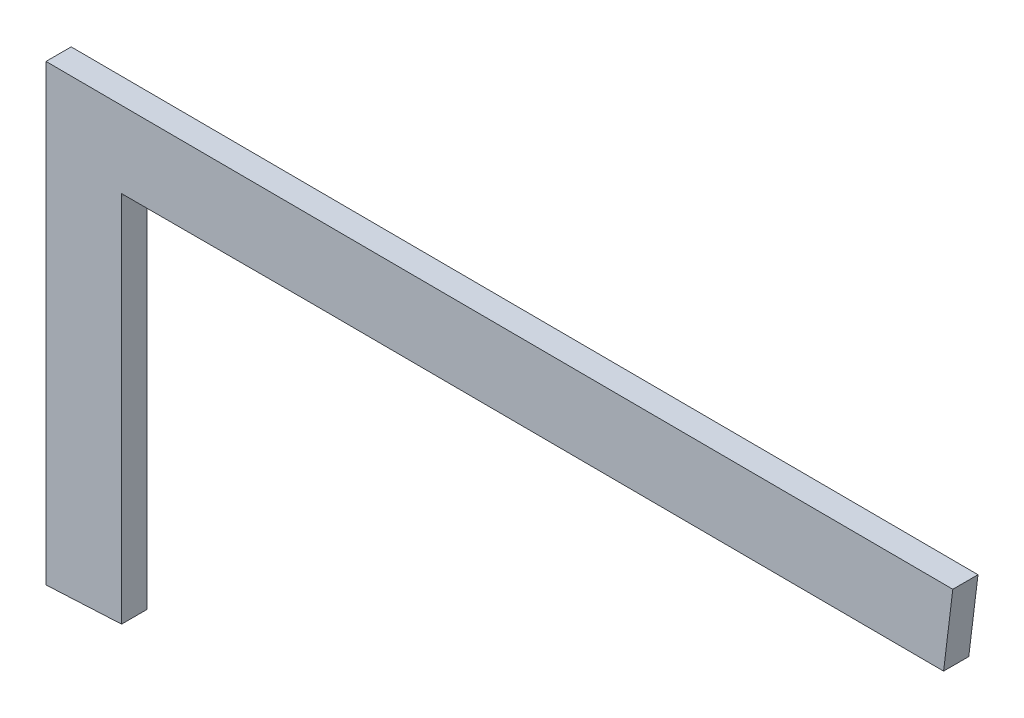
from build123d import *

# Parameters (mm, degrees)
BOSS_EXTRU_1_DEPTH = 5


with BuildPart() as part:
    # Esquisse1 → Boss.-Extru.1 (new body)
    with BuildSketch(Plane.XY):
        Polygon((89.060260617, 0.891311355), (-90.939739383, 1.631762021), (-90.939739383, -88.368237979), (-75.939739383, -87.61059081), (-75.939739383, -14.101288479), (-75.943836498, -13.587943417), (-37.561254863, -13.587943417), (87.23046396, -14.101288479), align=None)
    extrude(amount=BOSS_EXTRU_1_DEPTH)


solid = part.part
